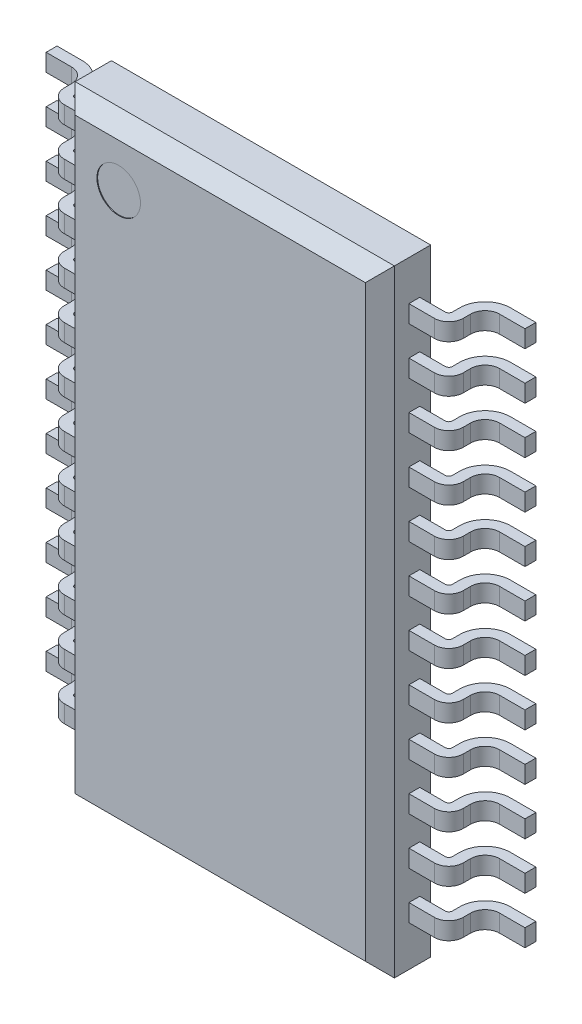
from build123d import *

# Parameters (mm, degrees)
SKETCH_1_W                 = 4.4
SKETCH_1_H                 = 8.5
EXTRUDE_1_DEPTH            = 0.9
CHAMFER_1_SIZE             = 0.2
SKETCH_6_W                 = 0.15
SKETCH_6_H                 = 0.24
PATTERN_LINEAR_1_COUNT     = 6
PATTERN_LINEAR_1_PITCH     = 0.65
PATTERN_LINEAR_1_COL_COUNT = 7
PATTERN_LINEAR_1_COL_PITCH = 0.65
MIRROR_1_COPY_1_SKETCH_W   = 0.15
MIRROR_1_COPY_1_SKETCH_H   = 0.24
MIRROR_1_COPY_2_SKETCH_W   = 0.15
MIRROR_1_COPY_2_SKETCH_H   = 0.24
MIRROR_1_COPY_3_SKETCH_W   = 0.15
MIRROR_1_COPY_3_SKETCH_H   = 0.24
MIRROR_1_COPY_4_SKETCH_W   = 0.15
MIRROR_1_COPY_4_SKETCH_H   = 0.24
MIRROR_1_COPY_5_SKETCH_W   = 0.15
MIRROR_1_COPY_5_SKETCH_H   = 0.24
MIRROR_1_COPY_6_SKETCH_W   = 0.15
MIRROR_1_COPY_6_SKETCH_H   = 0.24
MIRROR_1_COPY_7_SKETCH_W   = 0.15
MIRROR_1_COPY_7_SKETCH_H   = 0.24
MIRROR_1_COPY_8_SKETCH_W   = 0.15
MIRROR_1_COPY_8_SKETCH_H   = 0.24
MIRROR_1_COPY_9_SKETCH_W   = 0.15
MIRROR_1_COPY_9_SKETCH_H   = 0.24
MIRROR_1_COPY_10_SKETCH_W  = 0.15
MIRROR_1_COPY_10_SKETCH_H  = 0.24
MIRROR_1_COPY_11_SKETCH_W  = 0.15
MIRROR_1_COPY_11_SKETCH_H  = 0.24
SKETCH_7_R                 = 0.3
CUT_EXTRUDE_1_DEPTH        = 0.01


with BuildPart() as part:
    # 草图1 → 拉伸1 (new body)
    with BuildSketch(Plane.XY.offset(0.15)):
        with Locations((0, 0.65)):
            Rectangle(SKETCH_1_W, SKETCH_1_H)
    extrude(amount=EXTRUDE_1_DEPTH)

    # 倒角1
    chamfer_1_edges = [part.edges().sort_by_distance(p)[0] for p in [
        (2.2, 0.65, 1.05),
        (0, 4.9, 1.05),
        (-2.2, 0.65, 1.05),
        (0, 4.9, 0.15),
        (2.2, 0.65, 0.15),
        (0, -3.6, 0.15),
        (-2.2, 0.65, 0.15),
        (0, -3.6, 1.05),
    ]]
    chamfer(chamfer_1_edges, length=CHAMFER_1_SIZE)

    # 扫描1: sweep along a path in 草图5
    with BuildLine(Plane(origin=(0, 0.33, 0), x_dir=(1, 0, 0), z_dir=(0, 1, 0))) as sweep_1_path:
        Line((-2.2, -0.65), (-2.55, -0.65))
        ThreePointArc((-2.55, -0.65), (-2.691421356, -0.591421356), (-2.75, -0.45))
        Line((-2.75, -0.45), (-2.75, -0.35))
        ThreePointArc((-2.75, -0.35), (-2.808578644, -0.208578644), (-2.95, -0.15))
        Line((-2.95, -0.15), (-3.3, -0.15))
    # 草图6 → 扫描1 (sweep)
    with BuildSketch(Plane(origin=(-2.2, 0, 0), x_dir=(0, 0, -1), z_dir=(1, 0, 0))):
        with Locations((-0.575, 0.33)):
            Rectangle(SKETCH_6_W, SKETCH_6_H)
    sweep_1 = sweep(path=sweep_1_path.line)

    # 阵列(线性)1: 扫描1 ×6
    with Locations(*[(0, -i * PATTERN_LINEAR_1_PITCH, 0) for i in range(1, PATTERN_LINEAR_1_COUNT)]):
        add(sweep_1)

    # 阵列(线性)1 col: 扫描1 ×7
    with Locations(*[(0, i * PATTERN_LINEAR_1_COL_PITCH, 0) for i in range(1, PATTERN_LINEAR_1_COL_COUNT)]):
        add(sweep_1)

    # 镜向1: 扫描1 across plane
    add(sweep_1.mirror(Plane(origin=(0, 0, 0), x_dir=(0, 0, 1), z_dir=(1, 0, 0))))

    # 镜向1 copy 1: sweep along a path in 镜向1 copy 1 path
    with BuildLine(Plane(origin=(0, -0.32, 0), x_dir=(-1, 0, 0), z_dir=(0, 1, 0))) as mirror_1_copy_1_path:
        Line((-2.2, 0.65), (-2.55, 0.65))
        ThreePointArc((-2.55, 0.65), (-2.691421356, 0.591421356), (-2.75, 0.45))
        Line((-2.75, 0.45), (-2.75, 0.35))
        ThreePointArc((-2.75, 0.35), (-2.808578644, 0.208578644), (-2.95, 0.15))
        Line((-2.95, 0.15), (-3.3, 0.15))
    # 镜向1 copy 1 sketch → 镜向1 copy 1 (sweep)
    with BuildSketch(Plane(origin=(2.2, -0.65, 0), x_dir=(0, 0, -1), z_dir=(-1, 0, 0))):
        with Locations((-0.575, -0.33)):
            Rectangle(MIRROR_1_COPY_1_SKETCH_W, MIRROR_1_COPY_1_SKETCH_H)
    sweep(path=mirror_1_copy_1_path.line)

    # 镜向1 copy 2: sweep along a path in 镜向1 copy 2 path
    with BuildLine(Plane(origin=(0, -0.97, 0), x_dir=(-1, 0, 0), z_dir=(0, 1, 0))) as mirror_1_copy_2_path:
        Line((-2.2, 0.65), (-2.55, 0.65))
        ThreePointArc((-2.55, 0.65), (-2.691421356, 0.591421356), (-2.75, 0.45))
        Line((-2.75, 0.45), (-2.75, 0.35))
        ThreePointArc((-2.75, 0.35), (-2.808578644, 0.208578644), (-2.95, 0.15))
        Line((-2.95, 0.15), (-3.3, 0.15))
    # 镜向1 copy 2 sketch → 镜向1 copy 2 (sweep)
    with BuildSketch(Plane(origin=(2.2, -1.3, 0), x_dir=(0, 0, -1), z_dir=(-1, 0, 0))):
        with Locations((-0.575, -0.33)):
            Rectangle(MIRROR_1_COPY_2_SKETCH_W, MIRROR_1_COPY_2_SKETCH_H)
    sweep(path=mirror_1_copy_2_path.line)

    # 镜向1 copy 3: sweep along a path in 镜向1 copy 3 path
    with BuildLine(Plane(origin=(0, -1.62, 0), x_dir=(-1, 0, 0), z_dir=(0, 1, 0))) as mirror_1_copy_3_path:
        Line((-2.2, 0.65), (-2.55, 0.65))
        ThreePointArc((-2.55, 0.65), (-2.691421356, 0.591421356), (-2.75, 0.45))
        Line((-2.75, 0.45), (-2.75, 0.35))
        ThreePointArc((-2.75, 0.35), (-2.808578644, 0.208578644), (-2.95, 0.15))
        Line((-2.95, 0.15), (-3.3, 0.15))
    # 镜向1 copy 3 sketch → 镜向1 copy 3 (sweep)
    with BuildSketch(Plane(origin=(2.2, -1.95, 0), x_dir=(0, 0, -1), z_dir=(-1, 0, 0))):
        with Locations((-0.575, -0.33)):
            Rectangle(MIRROR_1_COPY_3_SKETCH_W, MIRROR_1_COPY_3_SKETCH_H)
    sweep(path=mirror_1_copy_3_path.line)

    # 镜向1 copy 4: sweep along a path in 镜向1 copy 4 path
    with BuildLine(Plane(origin=(0, -2.27, 0), x_dir=(-1, 0, 0), z_dir=(0, 1, 0))) as mirror_1_copy_4_path:
        Line((-2.2, 0.65), (-2.55, 0.65))
        ThreePointArc((-2.55, 0.65), (-2.691421356, 0.591421356), (-2.75, 0.45))
        Line((-2.75, 0.45), (-2.75, 0.35))
        ThreePointArc((-2.75, 0.35), (-2.808578644, 0.208578644), (-2.95, 0.15))
        Line((-2.95, 0.15), (-3.3, 0.15))
    # 镜向1 copy 4 sketch → 镜向1 copy 4 (sweep)
    with BuildSketch(Plane(origin=(2.2, -2.6, 0), x_dir=(0, 0, -1), z_dir=(-1, 0, 0))):
        with Locations((-0.575, -0.33)):
            Rectangle(MIRROR_1_COPY_4_SKETCH_W, MIRROR_1_COPY_4_SKETCH_H)
    sweep(path=mirror_1_copy_4_path.line)

    # 镜向1 copy 5: sweep along a path in 镜向1 copy 5 path
    with BuildLine(Plane(origin=(0, -2.92, 0), x_dir=(-1, 0, 0), z_dir=(0, 1, 0))) as mirror_1_copy_5_path:
        Line((-2.2, 0.65), (-2.55, 0.65))
        ThreePointArc((-2.55, 0.65), (-2.691421356, 0.591421356), (-2.75, 0.45))
        Line((-2.75, 0.45), (-2.75, 0.35))
        ThreePointArc((-2.75, 0.35), (-2.808578644, 0.208578644), (-2.95, 0.15))
        Line((-2.95, 0.15), (-3.3, 0.15))
    # 镜向1 copy 5 sketch → 镜向1 copy 5 (sweep)
    with BuildSketch(Plane(origin=(2.2, -3.25, 0), x_dir=(0, 0, -1), z_dir=(-1, 0, 0))):
        with Locations((-0.575, -0.33)):
            Rectangle(MIRROR_1_COPY_5_SKETCH_W, MIRROR_1_COPY_5_SKETCH_H)
    sweep(path=mirror_1_copy_5_path.line)

    # 镜向1 copy 6: sweep along a path in 镜向1 copy 6 path
    with BuildLine(Plane(origin=(0, 0.98, 0), x_dir=(-1, 0, 0), z_dir=(0, 1, 0))) as mirror_1_copy_6_path:
        Line((-2.2, 0.65), (-2.55, 0.65))
        ThreePointArc((-2.55, 0.65), (-2.691421356, 0.591421356), (-2.75, 0.45))
        Line((-2.75, 0.45), (-2.75, 0.35))
        ThreePointArc((-2.75, 0.35), (-2.808578644, 0.208578644), (-2.95, 0.15))
        Line((-2.95, 0.15), (-3.3, 0.15))
    # 镜向1 copy 6 sketch → 镜向1 copy 6 (sweep)
    with BuildSketch(Plane(origin=(2.2, 0.65, 0), x_dir=(0, 0, -1), z_dir=(-1, 0, 0))):
        with Locations((-0.575, -0.33)):
            Rectangle(MIRROR_1_COPY_6_SKETCH_W, MIRROR_1_COPY_6_SKETCH_H)
    sweep(path=mirror_1_copy_6_path.line)

    # 镜向1 copy 7: sweep along a path in 镜向1 copy 7 path
    with BuildLine(Plane(origin=(0, 1.63, 0), x_dir=(-1, 0, 0), z_dir=(0, 1, 0))) as mirror_1_copy_7_path:
        Line((-2.2, 0.65), (-2.55, 0.65))
        ThreePointArc((-2.55, 0.65), (-2.691421356, 0.591421356), (-2.75, 0.45))
        Line((-2.75, 0.45), (-2.75, 0.35))
        ThreePointArc((-2.75, 0.35), (-2.808578644, 0.208578644), (-2.95, 0.15))
        Line((-2.95, 0.15), (-3.3, 0.15))
    # 镜向1 copy 7 sketch → 镜向1 copy 7 (sweep)
    with BuildSketch(Plane(origin=(2.2, 1.3, 0), x_dir=(0, 0, -1), z_dir=(-1, 0, 0))):
        with Locations((-0.575, -0.33)):
            Rectangle(MIRROR_1_COPY_7_SKETCH_W, MIRROR_1_COPY_7_SKETCH_H)
    sweep(path=mirror_1_copy_7_path.line)

    # 镜向1 copy 8: sweep along a path in 镜向1 copy 8 path
    with BuildLine(Plane(origin=(0, 2.28, 0), x_dir=(-1, 0, 0), z_dir=(0, 1, 0))) as mirror_1_copy_8_path:
        Line((-2.2, 0.65), (-2.55, 0.65))
        ThreePointArc((-2.55, 0.65), (-2.691421356, 0.591421356), (-2.75, 0.45))
        Line((-2.75, 0.45), (-2.75, 0.35))
        ThreePointArc((-2.75, 0.35), (-2.808578644, 0.208578644), (-2.95, 0.15))
        Line((-2.95, 0.15), (-3.3, 0.15))
    # 镜向1 copy 8 sketch → 镜向1 copy 8 (sweep)
    with BuildSketch(Plane(origin=(2.2, 1.95, 0), x_dir=(0, 0, -1), z_dir=(-1, 0, 0))):
        with Locations((-0.575, -0.33)):
            Rectangle(MIRROR_1_COPY_8_SKETCH_W, MIRROR_1_COPY_8_SKETCH_H)
    sweep(path=mirror_1_copy_8_path.line)

    # 镜向1 copy 9: sweep along a path in 镜向1 copy 9 path
    with BuildLine(Plane(origin=(0, 2.93, 0), x_dir=(-1, 0, 0), z_dir=(0, 1, 0))) as mirror_1_copy_9_path:
        Line((-2.2, 0.65), (-2.55, 0.65))
        ThreePointArc((-2.55, 0.65), (-2.691421356, 0.591421356), (-2.75, 0.45))
        Line((-2.75, 0.45), (-2.75, 0.35))
        ThreePointArc((-2.75, 0.35), (-2.808578644, 0.208578644), (-2.95, 0.15))
        Line((-2.95, 0.15), (-3.3, 0.15))
    # 镜向1 copy 9 sketch → 镜向1 copy 9 (sweep)
    with BuildSketch(Plane(origin=(2.2, 2.6, 0), x_dir=(0, 0, -1), z_dir=(-1, 0, 0))):
        with Locations((-0.575, -0.33)):
            Rectangle(MIRROR_1_COPY_9_SKETCH_W, MIRROR_1_COPY_9_SKETCH_H)
    sweep(path=mirror_1_copy_9_path.line)

    # 镜向1 copy 10: sweep along a path in 镜向1 copy 10 path
    with BuildLine(Plane(origin=(0, 3.58, 0), x_dir=(-1, 0, 0), z_dir=(0, 1, 0))) as mirror_1_copy_10_path:
        Line((-2.2, 0.65), (-2.55, 0.65))
        ThreePointArc((-2.55, 0.65), (-2.691421356, 0.591421356), (-2.75, 0.45))
        Line((-2.75, 0.45), (-2.75, 0.35))
        ThreePointArc((-2.75, 0.35), (-2.808578644, 0.208578644), (-2.95, 0.15))
        Line((-2.95, 0.15), (-3.3, 0.15))
    # 镜向1 copy 10 sketch → 镜向1 copy 10 (sweep)
    with BuildSketch(Plane(origin=(2.2, 3.25, 0), x_dir=(0, 0, -1), z_dir=(-1, 0, 0))):
        with Locations((-0.575, -0.33)):
            Rectangle(MIRROR_1_COPY_10_SKETCH_W, MIRROR_1_COPY_10_SKETCH_H)
    sweep(path=mirror_1_copy_10_path.line)

    # 镜向1 copy 11: sweep along a path in 镜向1 copy 11 path
    with BuildLine(Plane(origin=(0, 4.23, 0), x_dir=(-1, 0, 0), z_dir=(0, 1, 0))) as mirror_1_copy_11_path:
        Line((-2.2, 0.65), (-2.55, 0.65))
        ThreePointArc((-2.55, 0.65), (-2.691421356, 0.591421356), (-2.75, 0.45))
        Line((-2.75, 0.45), (-2.75, 0.35))
        ThreePointArc((-2.75, 0.35), (-2.808578644, 0.208578644), (-2.95, 0.15))
        Line((-2.95, 0.15), (-3.3, 0.15))
    # 镜向1 copy 11 sketch → 镜向1 copy 11 (sweep)
    with BuildSketch(Plane(origin=(2.2, 3.9, 0), x_dir=(0, 0, -1), z_dir=(-1, 0, 0))):
        with Locations((-0.575, -0.33)):
            Rectangle(MIRROR_1_COPY_11_SKETCH_W, MIRROR_1_COPY_11_SKETCH_H)
    sweep(path=mirror_1_copy_11_path.line)

    # 草图7 → 切除-拉伸1 (cut)
    with BuildSketch(Plane.XY.offset(1.05)):
        with Locations((-1.4, 4.1)):
            Circle(SKETCH_7_R)
    extrude(amount=-CUT_EXTRUDE_1_DEPTH, mode=Mode.SUBTRACT)


solid = part.part
